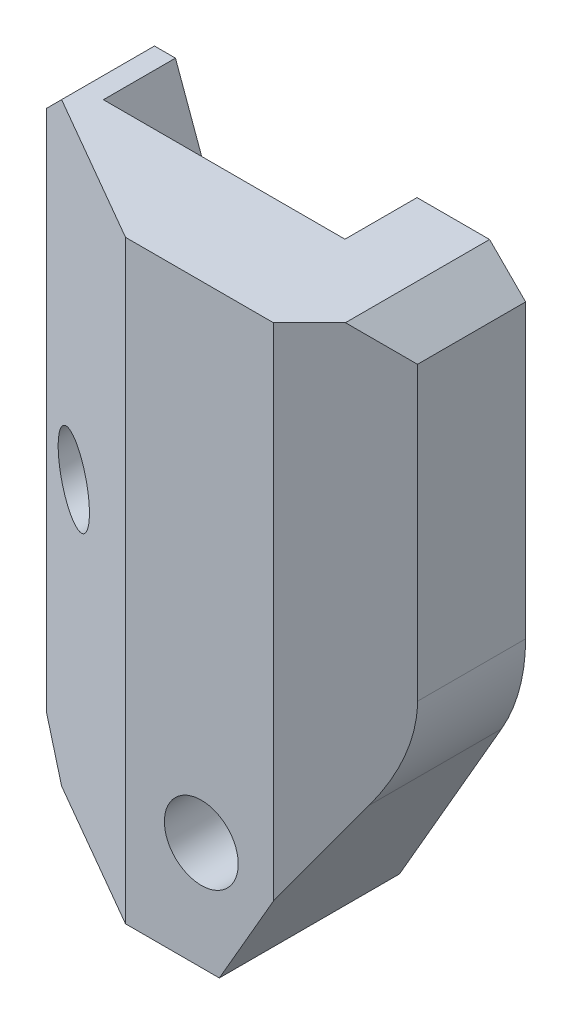
from build123d import *

# Parameters (mm, degrees)
SKETCH_1_W              = 5
SKETCH_1_H              = 20
EXTRUDE_1_DEPTH         = 5
SKETCH1_W               = 5
SKETCH1_H               = 20
EXTRUDE1_DEPTH          = 6.8
M2_5_TAPPED_HOLE1_D     = 2.05
M2_5_TAPPED_HOLE1_DEPTH = 6.35
M2_5_TAPPED_HOLE1_TIP   = 0.615882135
EXTRUDE2_DEPTH          = 2
CHAMFER1_SIZE           = 2
EXTRUDE3_START          = -5
SKETCH3_W               = 11.8
SKETCH3_H               = 3.5
EXTRUDE3_DEPTH          = 5
EXTRUDE4_DEPTH          = 2
CHAMFER2_SIZE           = 1
CHAMFER4_SIZE           = 3.5
CHAMFER4_SIZE2          = 6.062177826
SKETCH8_W               = 1
SKETCH8_H               = 16.5
EXTRUDE6_DEPTH          = 10
SKETCH11_W              = 5
SKETCH11_H              = 16.5
EXTRUDE8_DEPTH          = 0.5
EXTRUDE7_REACH          = 21.357
CHAMFER7_SIZE           = 1
FILLET1_R               = 5


with BuildPart() as part:
    # 草图1 → 拉伸1 (new body)
    with BuildSketch(Plane.XY):
        Rectangle(SKETCH_1_W, SKETCH_1_H)
    extrude(amount=EXTRUDE_1_DEPTH)

    # Sketch1 → Extrude1 (add)
    with BuildSketch(Plane.ZY.offset(2.5)):
        with Locations((2.5, 0)):
            Rectangle(SKETCH1_W, SKETCH1_H)
    extrude(amount=EXTRUDE1_DEPTH)

    # M2.5 Tapped Hole1
    with Locations(Plane(origin=(-1.5, -7, 5), x_dir=(1, 0, 0), z_dir=(0, 0, 1))):
        with Locations((0, 0), (-5.5, 5)):
            Hole(M2_5_TAPPED_HOLE1_D / 2, depth=M2_5_TAPPED_HOLE1_DEPTH)
            with Locations((0, 0, -(M2_5_TAPPED_HOLE1_DEPTH + M2_5_TAPPED_HOLE1_TIP / 2))):  # 118° drill point
                Cone(0, M2_5_TAPPED_HOLE1_D / 2, M2_5_TAPPED_HOLE1_TIP, mode=Mode.SUBTRACT)

    # Sketch2 → Extrude2 (cut)
    with BuildSketch(Plane(origin=(0, 0, 0), x_dir=(-1, 0, 0), z_dir=(0, 0, -1))):
        with BuildLine():
            Line((-2.383486142, -1.459806625), (0.079058889, 5.305980245))
            ThreePointArc((0.079058889, 5.305980245), (0.596133249, 5.870267889), (1.360771654, 5.903652722))
            Line((1.360771654, 5.903652722), (5.401449923, 4.432966106))
            ThreePointArc((5.401449923, 4.432966106), (5.965737567, 3.915891747), (5.9991224, 3.151253342))
            Line((5.9991224, 3.151253342), (3.536577368, -3.614533528))
            ThreePointArc((3.536577368, -3.614533528), (3.019503009, -4.178821171), (2.254864604, -4.212206005))
            Line((2.254864604, -4.212206005), (-1.785813665, -2.741519389))
            ThreePointArc((-1.785813665, -2.741519389), (-2.350101309, -2.22444503), (-2.383486142, -1.459806625))
        make_face()
    extrude(amount=-EXTRUDE2_DEPTH, mode=Mode.SUBTRACT)

    # Chamfer1
    chamfer1_edges = [part.edges().sort_by_distance(p)[0] for p in [
        (2.5, 0, 5),
    ]]
    chamfer(chamfer1_edges, length=CHAMFER1_SIZE)

    # Sketch3 → Extrude3 (cut)
    with BuildSketch(Plane.XY.offset(5).offset(EXTRUDE3_START)):
        with Locations((-3.4, 8.25)):
            Rectangle(SKETCH3_W, SKETCH3_H)
    extrude(amount=EXTRUDE3_DEPTH, mode=Mode.SUBTRACT)

    # Sketch4 → Extrude4 (cut)
    with BuildSketch(Plane(origin=(0, 0, 0), x_dir=(-1, 0, 0), z_dir=(0, 0, -1))):
        Polygon((-0.262961254, 4.366287624), (1.447139463, 9.064750728), (7.367202974, 6.910023825), (5.657102257, 2.211560721), align=None)
    extrude(amount=-EXTRUDE4_DEPTH, mode=Mode.SUBTRACT)

    # Chamfer2
    chamfer2_edges = [part.edges().sort_by_distance(p)[0] for p in [
        (-9.3, 6.5, 2.5),
    ]]
    chamfer(chamfer2_edges, length=CHAMFER2_SIZE)

    # Chamfer4
    chamfer4_edges = [part.edges().sort_by_distance(p)[0] for p in [
        (2.5, -10, 1.5),
    ]]
    chamfer4_side = [part.faces().sort_by_distance(p)[0] for p in [
        (-3.583625731, -10, 2.435672515),
    ]]
    chamfer(chamfer4_edges, length=CHAMFER4_SIZE, length2=CHAMFER4_SIZE2, reference=chamfer4_side[0])

    # Sketch8 → Extrude6 (cut)
    with BuildSketch(Plane.XY.offset(5)):
        with Locations((-8.8, -1.75)):
            Rectangle(SKETCH8_W, SKETCH8_H)
    extrude(amount=-EXTRUDE6_DEPTH, mode=Mode.SUBTRACT)

    # Sketch11 → Extrude8 (add)
    with BuildSketch(Plane.ZY.offset(8.3)):
        with Locations((2.5, -1.75)):
            Rectangle(SKETCH11_W, SKETCH11_H)
    extrude(amount=EXTRUDE8_DEPTH)

    # Extrude7: up to this face of the body (flat: up to its plane)
    extrude7_end = Plane(part.part.faces().sort_by_distance((-4.9, -10, 2.5))[0])
    # Sketch10 → Extrude7 (cut, up to the picked face)
    with BuildSketch(Plane(origin=(0, 6.5, 0), x_dir=(1, 0, 0), z_dir=(0, 1, 0)), mode=Mode.PRIVATE) as extrude7_sk1:
        Polygon((-8.8, -2), (-3.603847577, -5), (-8.8, -5), align=None)
    extrude7_tool1 = split(extrude(extrude7_sk1.sketch, amount=-EXTRUDE7_REACH, mode=Mode.PRIVATE), bisect_by=extrude7_end, keep=Keep.BOTH, mode=Mode.PRIVATE)
    add(extrude7_tool1.solids().sort_by(Axis((-7.067949, 6.5, 4), (0, -1, 0)))[0], mode=Mode.SUBTRACT)

    # Chamfer7
    chamfer7_edges = [part.edges().sort_by_distance(p)[0] for p in [
        (-8.8, -10, 1),
        (-8.8, 6.5, 1),
        (2.5, 6.5, 1.5),
    ]]
    chamfer(chamfer7_edges, length=CHAMFER7_SIZE)

    # Fillet1
    fillet1_edges = [part.edges().sort_by_distance(p)[0] for p in [
        (2.5, -3.937822174, 1.5),
    ]]
    fillet(fillet1_edges, radius=FILLET1_R)


solid = part.part
